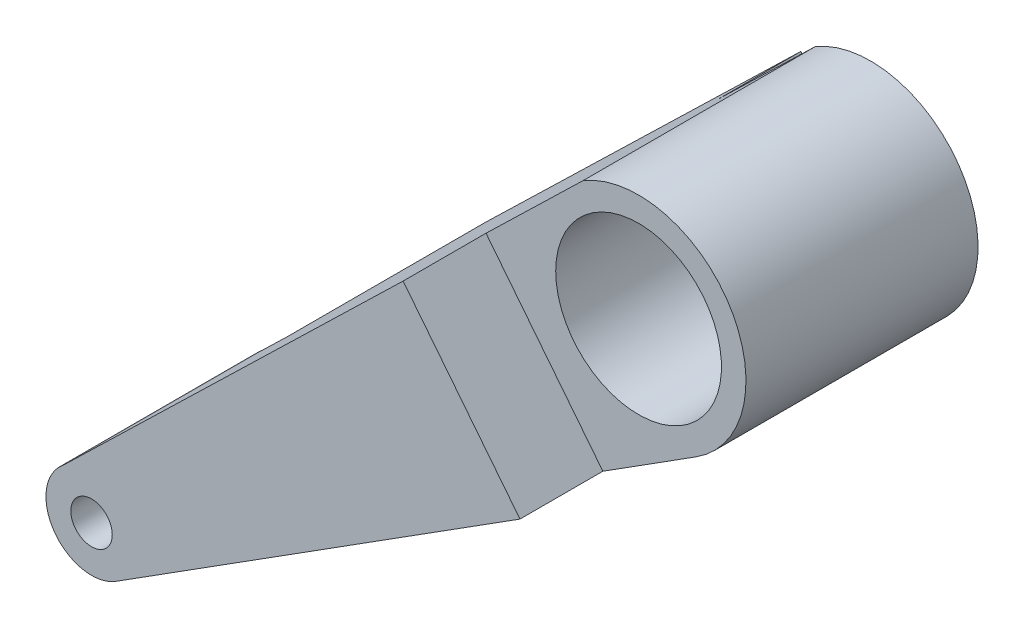
from build123d import *

# Parameters (mm, degrees)
SKETCH_3_R               = 2.5
SKETCH_3_R_2             = 1.375
SKETCH_3_R_3             = 0.625
EXTRUDE_1_DEPTH          = 12
CUT_EXTRUDE_START        = -6
SKETCH_4_R               = 1.375
SKETCH_4_R_2             = 0.625
CUT_EXTRUDE_1_DEPTH      = 6
CUT_EXTRUDE_2_DEPTH      = 6
CUT_EXTRUDE_3_DEPTH      = 98.323451249
CUT_EXTRUDE_3_DEPTH_BACK = 98.323451249
SKETCH_9_W               = 7.034569735
SKETCH_9_H               = 2.5


with BuildPart() as part:
    # 草图3 → 凸台-拉伸1 (new body)
    # profile 1 of 4: a face of its own
    with BuildSketch(Plane.XY):
        with BuildLine():
            ThreePointArc((-61.260434814, -42.25), (-62.911250508, -39.426764685), (-66.181254237, -39.480854503))
            Line((-66.181254237, -39.480854503), (-67.215081256, -40.482765899))
            ThreePointArc((-67.215081256, -40.482765899), (-66.804847725, -44.526501605), (-62.766497887, -44.986741313))
            ThreePointArc((-62.766497887, -44.986741313), (-61.661816101, -43.8118882), (-61.260434814, -42.25))
        make_face()
        with Locations((-64.5, -42.25)):
            Circle(SKETCH_3_R, mode=Mode.SUBTRACT)
    # profile 2 of 4: a face of its own
    with BuildSketch(Plane.XY):
        with BuildLine():
            ThreePointArc((-62.766497887, -44.986741313), (-66.804847725, -44.526501605), (-67.215081256, -40.482765899))
            Line((-67.215081256, -40.482765899), (-71.404577544, -44.542926834))
            Line((-71.404577544, -44.542926834), (-68.869512223, -46.563873564))
            ThreePointArc((-68.869512223, -46.563873564), (-68.283195443, -46.88782244), (-67.622796748, -47))
            Line((-67.622796748, -47), (-65.944900832, -47))
            Line((-65.944900832, -47), (-62.766497887, -44.986741313))
        make_face()
    # profile 3 of 4: a face of its own
    with BuildSketch(Plane.XY):
        with Locations((-78.5, -53.325)):
            Circle(SKETCH_3_R_2)
        with Locations((-78.5, -53.325)):
            Circle(SKETCH_3_R_3, mode=Mode.SUBTRACT)
    # profile 4 of 4: a face of its own
    with BuildSketch(Plane.XY):
        with BuildLine():
            Line((-68.869512223, -46.563873564), (-71.404577544, -44.542926834))
            Line((-71.404577544, -44.542926834), (-79.356399518, -52.24926543))
            ThreePointArc((-79.356399518, -52.24926543), (-77.902892111, -52.086417274), (-77.125, -53.325))
            ThreePointArc((-77.125, -53.325), (-77.295362144, -53.987927323), (-77.764232924, -54.486581598))
            Line((-77.764232924, -54.486581598), (-65.944900832, -47))
            Line((-65.944900832, -47), (-67.622796748, -47))
            ThreePointArc((-67.622796748, -47), (-68.283195443, -46.88782244), (-68.869512223, -46.563873564))
        make_face()
    extrude(amount=EXTRUDE_1_DEPTH)

    # 草图4 → 切除-拉伸1 (cut)
    with BuildSketch(Plane.XY.offset(6).offset(CUT_EXTRUDE_START)):
        with Locations((-78.5, -53.325)):
            Circle(SKETCH_4_R)
        with Locations((-78.5, -53.325)):
            Circle(SKETCH_4_R_2, mode=Mode.SUBTRACT)
    extrude(amount=CUT_EXTRUDE_1_DEPTH, mode=Mode.SUBTRACT)

    # 草图5 → 切除-拉伸2 (cut)
    with BuildSketch(Plane(origin=(0, 0, 0), x_dir=(-1, 0, 0), z_dir=(0, 0, -1))):
        with BuildLine():
            Line((79.356399518, -52.24926543), (78.605866383, -51.521902256))
            ThreePointArc((78.605866383, -51.521902256), (78.66209541, -51.603950043), (78.681882496, -51.701428318))
            ThreePointArc((78.681882496, -51.701428318), (78.612326251, -51.874460255), (78.442362088, -51.951208578))
            ThreePointArc((78.442362088, -51.951208578), (78.926279835, -52.017746963), (79.356399518, -52.24926543))
        make_face()
        with BuildLine():
            Line((79.691485429, -51.10916302), (78.328547162, -51.10916302))
            Line((78.328547162, -51.10916302), (78.328547162, -51.253144251))
            Line((78.328547162, -51.253144251), (78.605866383, -51.521902256))
            Line((78.605866383, -51.521902256), (79.356399518, -52.24926543))
            ThreePointArc((79.356399518, -52.24926543), (78.926279835, -52.017746963), (78.442362088, -51.951208578))
            ThreePointArc((78.442362088, -51.951208578), (78.385355708, -51.954787722), (78.328547162, -51.960731359))
            Line((78.328547162, -51.960731359), (78.328547162, -52.568011757))
            Line((78.328547162, -52.568011757), (79.691485429, -52.568011757))
            Line((79.691485429, -52.568011757), (79.691485429, -51.10916302))
        make_face()
        with BuildLine():
            Line((76.773632808, -53.859117327), (76.559713092, -53.723616657))
            Line((76.559713092, -53.723616657), (76.559713092, -54.626372146))
            Line((76.559713092, -54.626372146), (77.832544784, -54.626372146))
            Line((77.832544784, -54.626372146), (77.832544784, -53.006023906))
            Line((77.832544784, -53.006023906), (77.162510093, -53.006023906))
            ThreePointArc((77.162510093, -53.006023906), (77.125199423, -53.301582625), (77.152422696, -53.598240569))
            ThreePointArc((77.152422696, -53.598240569), (77.36758294, -54.104908073), (77.764232924, -54.486581598))
            Line((77.764232924, -54.486581598), (76.773632808, -53.859117327))
        make_face()
        with BuildLine():
            ThreePointArc((77.152422696, -53.598240569), (77.049210108, -53.853814684), (76.773632808, -53.859117327))
            Line((76.773632808, -53.859117327), (77.764232924, -54.486581598))
            ThreePointArc((77.764232924, -54.486581598), (77.36758294, -54.104908073), (77.152422696, -53.598240569))
        make_face()
    extrude(amount=-CUT_EXTRUDE_2_DEPTH, mode=Mode.SUBTRACT)

    # 草图9 → 切除-拉伸3 (cut, two sides: drawn at the far end of the back side and taken through both)
    with BuildSketch(Plane(origin=(-4.269265018, 5.396813566, 0), x_dir=(-0.784272958804573, -0.6204159299114752, 0), z_dir=(0.6204159299114752, -0.784272958804573, 0)).offset(-CUT_EXTRUDE_3_DEPTH_BACK)):
        with Locations((76.928026692, -1.25)):
            Rectangle(SKETCH_9_W, SKETCH_9_H)
        Polygon((74.298785761, -9.5), (73.410741824, -9.5), (73.410741824, -12), (80.445311559, -12), (80.445311559, -9.5), align=None)
    extrude(amount=CUT_EXTRUDE_3_DEPTH + CUT_EXTRUDE_3_DEPTH_BACK, mode=Mode.SUBTRACT)


solid = part.part
